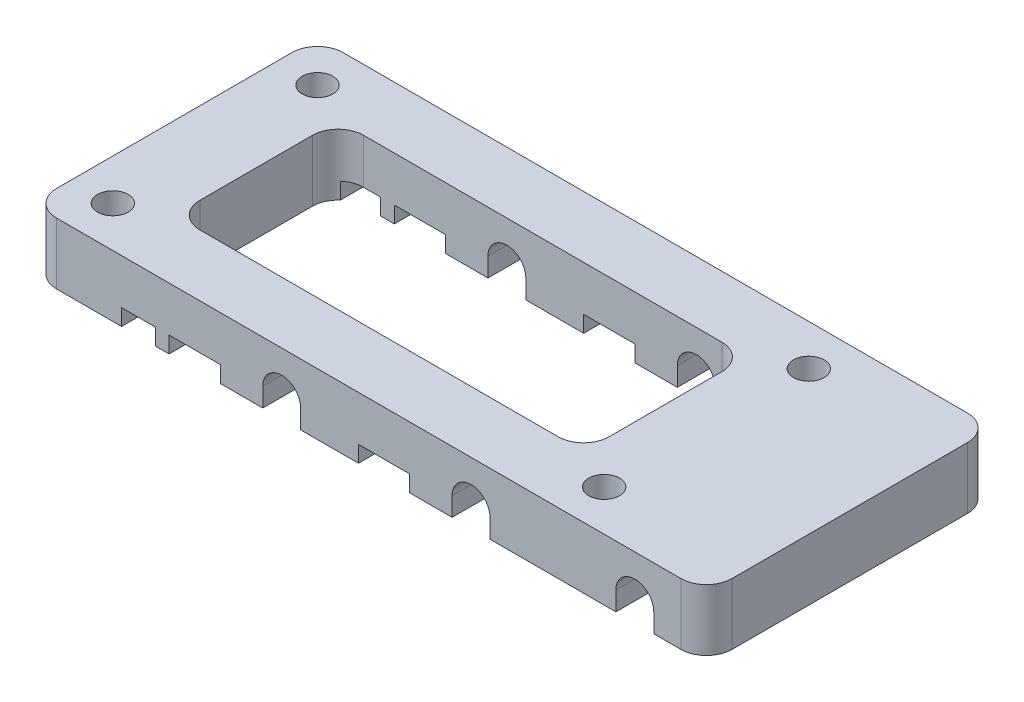
from build123d import *

# Parameters (mm, degrees)
SKETCH1_W           = 71.12
SKETCH1_H           = 35.56
SKETCH1_R           = 1.905
SKETCH1_W_2         = 50.8
SKETCH1_H_2         = 20.32
BOSS_EXTRUDE1_DEPTH = 7.62
SKETCH3_W           = 35.56
SKETCH3_H           = 7.62
BOSS_EXTRUDE2_DEPTH = 12.7
SKETCH2_W           = 6.35
SKETCH2_H           = 2.032
SKETCH2_W_2         = 4.191
CUT_EXTRUDE1_DEPTH  = 61.428516447
FILLET1_R           = 3.175


with BuildPart() as part:
    # Sketch1 → Boss-Extrude1 (new body)
    with BuildSketch(Plane(origin=(0, 0, 0), x_dir=(1, 0, 0), z_dir=(0, 1, 0))):
        Rectangle(SKETCH1_W, SKETCH1_H)
        with Locations(Location((30.48, 12.7, 0), (0, 0, 90))):
            Circle(SKETCH1_R, mode=Mode.SUBTRACT)
        with Locations(Location((-30.48, 12.7, 0), (0, 0, 90))):
            Circle(SKETCH1_R, mode=Mode.SUBTRACT)
        with Locations(Location((-30.48, -12.7, 0), (0, 0, 90))):
            Circle(SKETCH1_R, mode=Mode.SUBTRACT)
        with Locations(Location((30.48, -12.7, 0), (0, 0, 90))):
            Circle(SKETCH1_R, mode=Mode.SUBTRACT)
        Rectangle(SKETCH1_W_2, SKETCH1_H_2, mode=Mode.SUBTRACT)
    extrude(amount=BOSS_EXTRUDE1_DEPTH)

    # Sketch3 → Boss-Extrude2 (add)
    with BuildSketch(Plane(origin=(35.56, 0, 0), x_dir=(0, 0, -1), z_dir=(1, 0, 0))):
        with Locations((0, 3.81)):
            Rectangle(SKETCH3_W, SKETCH3_H)
    extrude(amount=BOSS_EXTRUDE2_DEPTH)

    # Sketch2 → Cut-Extrude1 (cut, through all)
    with BuildSketch(Plane.XY.offset(17.78)):
        with BuildLine():
            Line((21.3995, 2.3495), (21.3995, 0))
            Line((21.3995, 0), (16.7005, 0))
            Line((16.7005, 0), (16.7005, 2.3495))
            ThreePointArc((16.7005, 2.3495), (19.05, 4.699), (21.3995, 2.3495))
        make_face()
        with BuildLine():
            Line((-2.0955, 2.3495), (-2.0955, 0))
            Line((-2.0955, 0), (-6.7945, 0))
            Line((-6.7945, 0), (-6.7945, 2.3495))
            ThreePointArc((-6.7945, 2.3495), (-4.445, 4.699), (-2.0955, 2.3495))
        make_face()
        with Locations((8.255, 1.016)):
            Rectangle(SKETCH2_W, SKETCH2_H)
        with Locations((-15.24, 1.016)):
            Rectangle(SKETCH2_W, SKETCH2_H)
        with BuildLine():
            Line((41.7195, 2.3495), (41.7195, 0))
            Line((41.7195, 0), (37.0205, 0))
            Line((37.0205, 0), (37.0205, 2.3495))
            ThreePointArc((37.0205, 2.3495), (39.37, 4.699), (41.7195, 2.3495))
        make_face()
        with Locations((-22.225, 1.016)):
            Rectangle(SKETCH2_W_2, SKETCH2_H)
    extrude(amount=-CUT_EXTRUDE1_DEPTH, mode=Mode.SUBTRACT)

    # Fillet1
    fillet1_edges = [part.edges().sort_by_distance(p)[0] for p in [
        (-35.56, 3.81, -17.78),
        (-35.56, 3.81, 17.78),
        (48.26, 3.81, -17.78),
        (48.26, 3.81, 17.78),
        (25.4, 3.81, 10.16),
        (25.4, 3.81, -10.16),
        (-25.4, 3.81, -10.16),
        (-25.4, 3.81, 10.16),
    ]]
    fillet(fillet1_edges, radius=FILLET1_R)


solid = part.part
